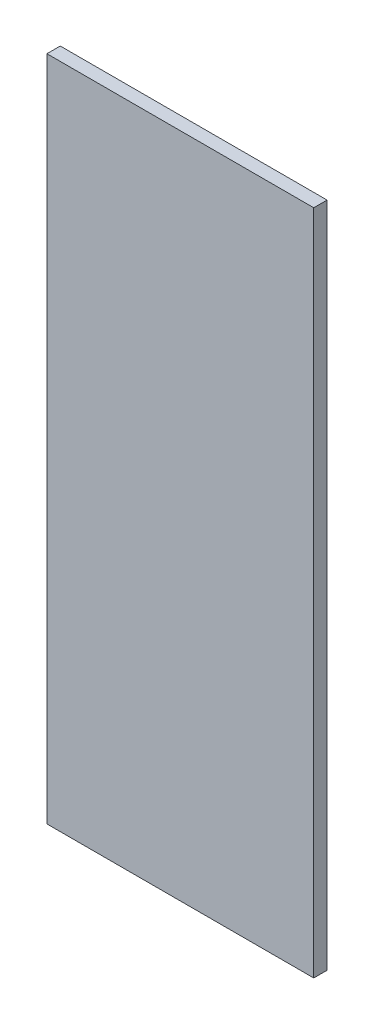
from build123d import *

# Parameters (mm, degrees)
SKETCH1_W           = 40
SKETCH1_H           = 2
BOSS_EXTRUDE1_DEPTH = 100


with BuildPart() as part:
    # Sketch1 → Boss-Extrude1 (new body)
    with BuildSketch(Plane(origin=(0, 0, 0), x_dir=(1, 0, 0), z_dir=(0, 1, 0))):
        Rectangle(SKETCH1_W, SKETCH1_H)
    extrude(amount=BOSS_EXTRUDE1_DEPTH)


solid = part.part
